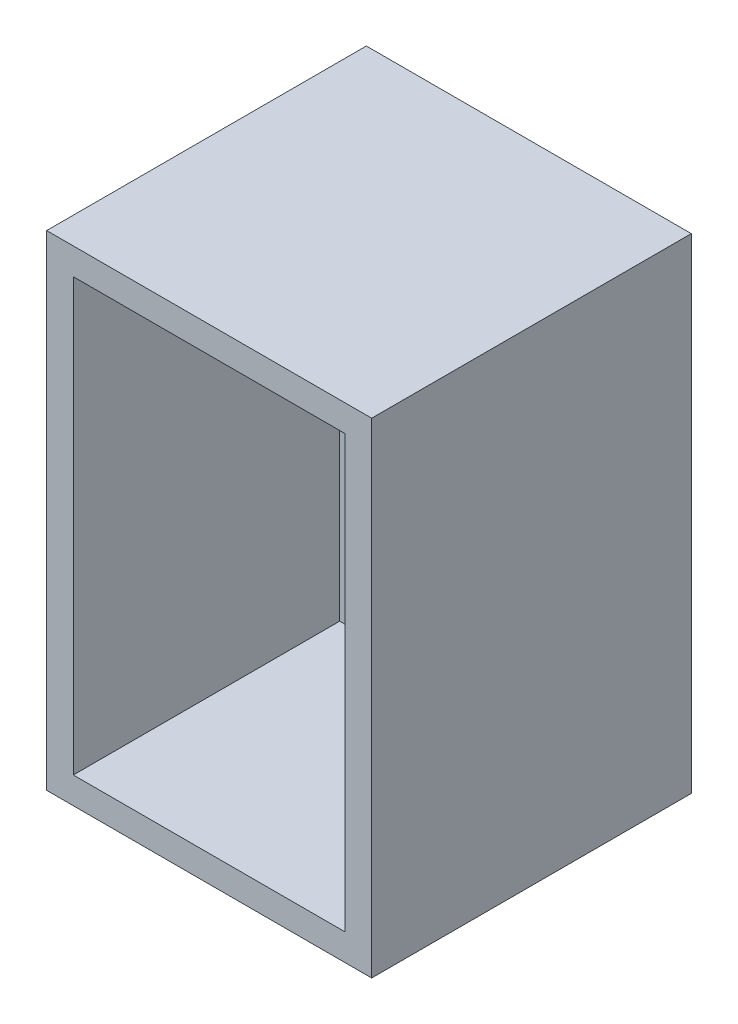
from build123d import *

# Parameters (mm, degrees)
SKETCH1_W           = 61
SKETCH1_H           = 91
SKETCH1_W_2         = 51
SKETCH1_H_2         = 81
BOSS_EXTRUDE1_DEPTH = 50
SKETCH2_W           = 61
SKETCH2_H           = 91
BOSS_EXTRUDE2_DEPTH = 10
SKETCH3_R           = 5
CUT_EXTRUDE1_DEPTH  = 10


with BuildPart() as part:
    # Sketch1 → Boss-Extrude1 (new body)
    with BuildSketch(Plane.XY):
        Rectangle(SKETCH1_W, SKETCH1_H)
        Rectangle(SKETCH1_W_2, SKETCH1_H_2, mode=Mode.SUBTRACT)
    extrude(amount=BOSS_EXTRUDE1_DEPTH)

    # Sketch2 → Boss-Extrude2 (add)
    with BuildSketch(Plane(origin=(0, 0, 0), x_dir=(-1, 0, 0), z_dir=(0, 0, -1))):
        Rectangle(SKETCH2_W, SKETCH2_H)
    extrude(amount=BOSS_EXTRUDE2_DEPTH)

    # Sketch3 → Cut-Extrude1 (cut)
    with BuildSketch(Plane(origin=(0, 0, -10), x_dir=(-1, 0, 0), z_dir=(0, 0, -1))):
        with Locations((0, -25)):
            Circle(SKETCH3_R)
    extrude(amount=-CUT_EXTRUDE1_DEPTH, mode=Mode.SUBTRACT)


solid = part.part
